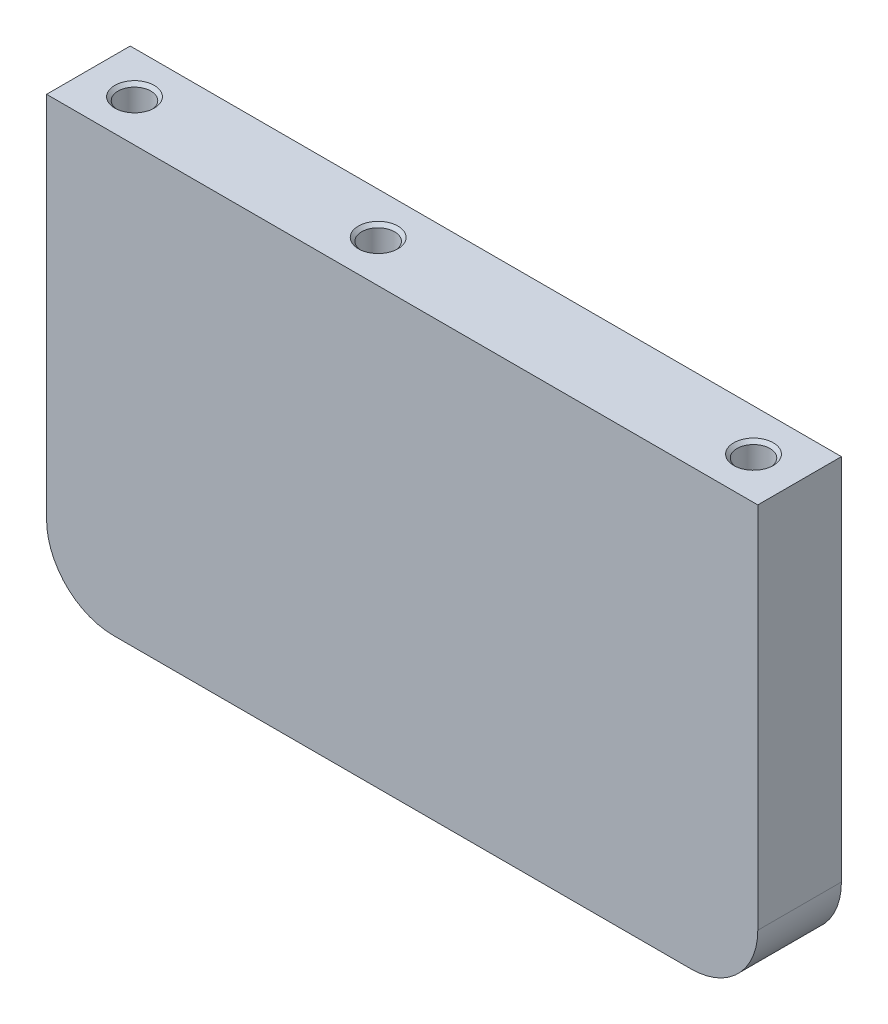
from build123d import *

# Parameters (mm, degrees)
SKETCH1_W           = 54
SKETCH1_H           = 33.05
BOSS_EXTRUDE1_DEPTH = 6.35
SKETCH8_R           = 1.25
CUT_EXTRUDE4_DEPTH  = 15
FILLET3_R           = 5.08
SKETCH10_R          = 3.35
SKETCH10_R_2        = 11.05
CUT_EXTRUDE5_DEPTH  = 4.7625
CHAMFER1_SIZE       = 0.25


with BuildPart() as part:
    # Sketch1 → Boss-Extrude1 (new body)
    with BuildSketch(Plane.XY):
        with Locations((-9, 2.525)):
            Rectangle(SKETCH1_W, SKETCH1_H)
    extrude(amount=-BOSS_EXTRUDE1_DEPTH)

    # Sketch8 → Cut-Extrude4 (cut)
    with BuildSketch(Plane(origin=(0, 19.05, 0), x_dir=(1, 0, 0), z_dir=(0, 1, 0))):
        with Locations(Location((-32.5, 3.175, 0), (0, 0, 270))):
            Circle(SKETCH8_R)
        with Locations(Location((-14, 3.175, 0), (0, 0, 270))):
            Circle(SKETCH8_R)
        with Locations(Location((14.5, 3.175, 0), (0, 0, 270))):
            Circle(SKETCH8_R)
    extrude(amount=-CUT_EXTRUDE4_DEPTH, mode=Mode.SUBTRACT)

    # Fillet3
    fillet3_edges = [part.edges().sort_by_distance(p)[0] for p in [
        (18, -14, -3.175),
        (-36, -14, -3.175),
    ]]
    fillet(fillet3_edges, radius=FILLET3_R)

    # Sketch10 → Cut-Extrude5 (cut)
    with BuildSketch(Plane(origin=(0, 0, -6.35), x_dir=(-1, 0, 0), z_dir=(0, 0, -1))):
        with Locations((25, 0)):
            Circle(SKETCH10_R)
        Circle(SKETCH10_R_2)
    extrude(amount=-CUT_EXTRUDE5_DEPTH, mode=Mode.SUBTRACT)

    # Chamfer1
    chamfer1_edges = [part.edges().sort_by_distance(p)[0] for p in [
        (-32.5, 19.05, -4.425),
        (-14, 19.05, -4.425),
        (14.5, 19.05, -4.425),
    ]]
    chamfer(chamfer1_edges, length=CHAMFER1_SIZE)


solid = part.part
